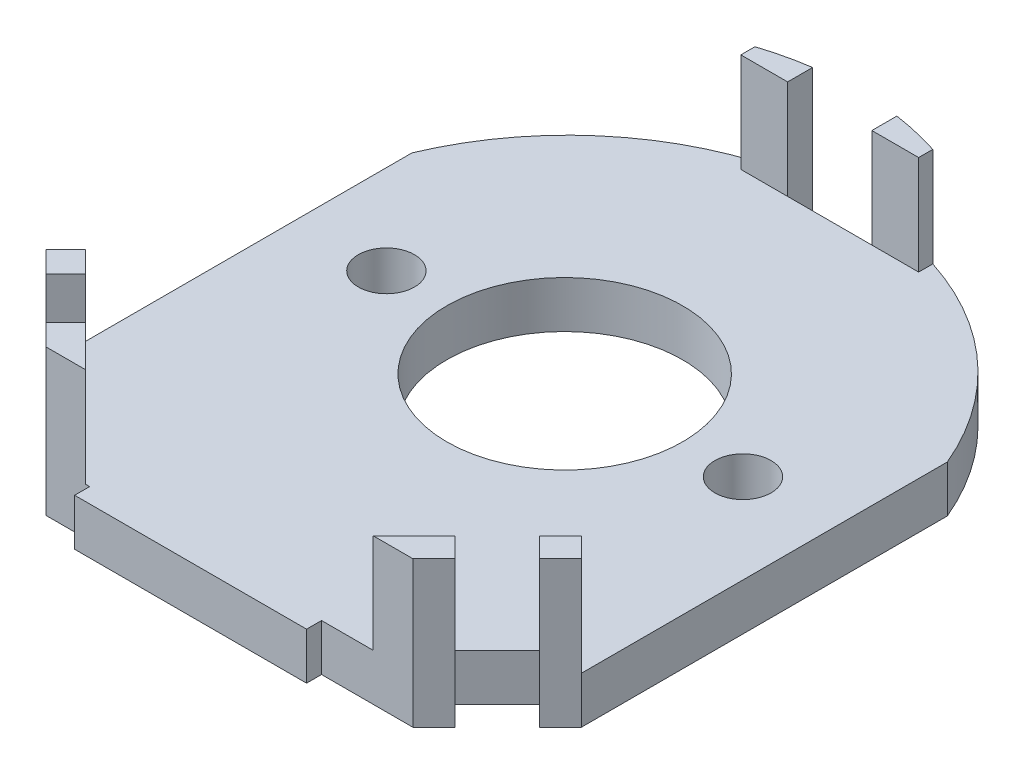
from build123d import *

# Parameters (mm, degrees)
SKETCH1_R               = 1.5
SKETCH1_R_2             = 6.3
BOSS_EXTRUDE1_DEPTH     = 2.5
CUT_EXTRUDE1_DEPTH      = 24.681302751
CUT_EXTRUDE1_DEPTH_BACK = 24.681302751
BOSS_EXTRUDE2_DEPTH     = 5.3


with BuildPart() as part:
    # Sketch1 → Boss-Extrude1 (new body)
    with BuildSketch(Plane(origin=(0, 0, 0), x_dir=(1, 0, 0), z_dir=(0, 1, 0))):
        with BuildLine():
            Line((-14.3, 6.139966555), (-14.3, -13.41))
            Line((-14.3, -13.41), (-9.8, -17.91))
            Line((-9.8, -17.91), (-7.47, -17.91))
            Line((-7.47, -17.91), (-7.47, -18.71))
            Line((-7.47, -18.71), (4.92, -18.71))
            Line((4.92, -18.71), (4.92, -17.91))
            Line((4.92, -17.91), (9.8, -17.91))
            Line((9.8, -17.91), (14.3, -13.41))
            Line((14.3, -13.41), (14.3, 6.139966555))
            ThreePointArc((14.3, 6.139966555), (9.505716305, 12.4030126), (2.25, 15.495824073))
            Line((2.25, 15.495824073), (2.25, 14.16))
            Line((2.25, 14.16), (-2.25, 14.16))
            Line((-2.25, 14.16), (-2.25, 15.495824073))
            ThreePointArc((-2.25, 15.495824073), (-9.505716305, 12.4030126), (-14.3, 6.139966555))
        make_face()
        with Locations(Location((9.525, 0, 0), (0, 0, 270))):
            Circle(SKETCH1_R, mode=Mode.SUBTRACT)
        with Locations(Location((-9.525, 0, 0), (0, 0, 90))):
            Circle(SKETCH1_R, mode=Mode.SUBTRACT)
        with Locations(Location((0, 0, 0), (0, 0, 270))):
            Circle(SKETCH1_R_2, mode=Mode.SUBTRACT)
    extrude(amount=BOSS_EXTRUDE1_DEPTH)

    # Sketch2 → Cut-Extrude1 (cut, two sides: drawn at the far end of the back side and taken through both)
    with BuildSketch(Plane(origin=(0, 2.5, 0), x_dir=(1, 0, 0), z_dir=(0, 1, 0)).offset(-CUT_EXTRUDE1_DEPTH_BACK)):
        Polygon((-12.120710678, -13.467968978), (-9.857968978, -15.730710678), (-10.91862915, -16.79137085), (-13.18137085, -14.52862915), align=None)
        Polygon((12.120710678, -13.467968978), (13.18137085, -14.52862915), (10.91862915, -16.79137085), (9.857968978, -15.730710678), align=None)
    extrude(amount=CUT_EXTRUDE1_DEPTH + CUT_EXTRUDE1_DEPTH_BACK, mode=Mode.SUBTRACT)

    # Sketch3 → Boss-Extrude2 (add)
    with BuildSketch(Plane(origin=(0, 2.5, 0), x_dir=(1, 0, 0), z_dir=(0, 1, 0))):
        Polygon((-13.18137085, -14.52862915), (-14.3, -13.41), (-13.239339828, -12.349339828), (-12.120710678, -13.467968978), align=None)
        Polygon((-10.91862915, -16.79137085), (-9.857968978, -15.730710678), (-7.678679656, -17.91), (-9.8, -17.91), align=None)
        Polygon((13.239339828, -12.349339828), (12.120710678, -13.467968978), (13.18137085, -14.52862915), (14.3, -13.41), align=None)
        Polygon((7.678679656, -17.91), (9.8, -17.91), (10.91862915, -16.79137085), (9.857968978, -15.730710678), align=None)
        with BuildLine():
            Line((2.25, 15.495824073), (2.25, 14.16))
            Line((2.25, 14.16), (4.75, 14.16))
            Line((4.75, 14.16), (4.75, 14.91423668))
            ThreePointArc((4.75, 14.91423668), (3.512059364, 15.256868517), (2.25, 15.495824073))
        make_face()
        with BuildLine():
            Line((-2.25, 15.495824073), (-2.25, 14.16))
            Line((-2.25, 14.16), (-4.75, 14.16))
            Line((-4.75, 14.16), (-4.75, 14.91423668))
            ThreePointArc((-4.75, 14.91423668), (-3.512059364, 15.256868517), (-2.25, 15.495824073))
        make_face()
    extrude(amount=BOSS_EXTRUDE2_DEPTH)


solid = part.part
